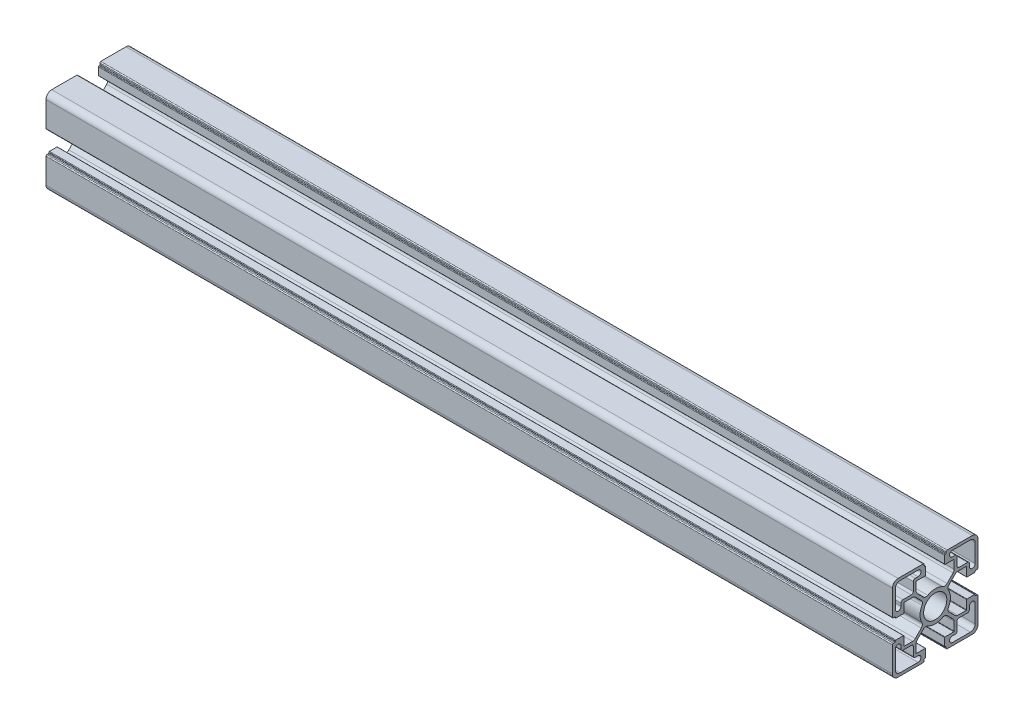
from build123d import *

# Parameters (mm, degrees)
BOSS_EXTRU_1_DEPTH = 222.5


with BuildPart() as part:
    # Esquisse1 → Boss.-Extru.1 (new, symmetric)
    with BuildSketch(Plane(origin=(0, 0, 0), x_dir=(0, 0, -1), z_dir=(1, 0, 0))):
        with BuildLine():
            Line((-22.5, 19.5), (-22.5, 6.3))
            ThreePointArc((-22.5, 6.3), (-22.353553391, 5.946446609), (-22, 5.8))
            Line((-22, 5.8), (-21.3, 5.8))
            ThreePointArc((-21.3, 5.8), (-21.087867966, 5.712132034), (-21, 5.5))
            Line((-21, 5.5), (-21, 5.3))
            ThreePointArc((-21, 5.3), (-20.912132034, 5.087867966), (-20.7, 5))
            Line((-20.7, 5), (-16.7, 5))
            ThreePointArc((-16.7, 5), (-16.558578644, 5.058578644), (-16.5, 5.2))
            Line((-16.5, 5.2), (-16.5, 9.8))
            ThreePointArc((-16.5, 9.8), (-16.441421356, 9.941421356), (-16.3, 10))
            Line((-16.3, 10), (-11.864234483, 10))
            ThreePointArc((-11.864234483, 10), (-11.121828624, 9.852326293), (-10.492447327, 9.431787156))
            Line((-10.492447327, 9.431787156), (-7.296699127, 6.236038955))
            ThreePointArc((-7.296699127, 6.236038955), (-6.746669172, 5.129240469), (-6.976648919, 3.914890784))
            ThreePointArc((-6.976648919, 3.914890784), (-7.739935121, 2.023216331), (-8, 0))
            ThreePointArc((-8, 0), (-7.739935121, -2.023216331), (-6.976648919, -3.914890784))
            ThreePointArc((-6.976648919, -3.914890784), (-6.746669172, -5.129240469), (-7.296699127, -6.236038955))
            Line((-7.296699127, -6.236038955), (-10.492447327, -9.431787156))
            ThreePointArc((-10.492447327, -9.431787156), (-11.121828624, -9.852326293), (-11.864234483, -10))
            Line((-11.864234483, -10), (-16.3, -10))
            ThreePointArc((-16.3, -10), (-16.441421356, -9.941421356), (-16.5, -9.8))
            Line((-16.5, -9.8), (-16.5, -5.2))
            ThreePointArc((-16.5, -5.2), (-16.558578644, -5.058578644), (-16.7, -5))
            Line((-16.7, -5), (-20.7, -5))
            ThreePointArc((-20.7, -5), (-20.912132034, -5.087867966), (-21, -5.3))
            Line((-21, -5.3), (-21, -5.5))
            ThreePointArc((-21, -5.5), (-21.087867966, -5.712132034), (-21.3, -5.8))
            Line((-21.3, -5.8), (-22, -5.8))
            ThreePointArc((-22, -5.8), (-22.353553391, -5.946446609), (-22.5, -6.3))
            Line((-22.5, -6.3), (-22.5, -19.5))
            ThreePointArc((-22.5, -19.5), (-21.621320344, -21.621320344), (-19.5, -22.5))
            Line((-19.5, -22.5), (-6.3, -22.5))
            ThreePointArc((-6.3, -22.5), (-5.946446609, -22.353553391), (-5.8, -22))
            Line((-5.8, -22), (-5.8, -21.3))
            ThreePointArc((-5.8, -21.3), (-5.712132034, -21.087867966), (-5.5, -21))
            Line((-5.5, -21), (-5.3, -21))
            ThreePointArc((-5.3, -21), (-5.087867966, -20.912132034), (-5, -20.7))
            Line((-5, -20.7), (-5, -16.7))
            ThreePointArc((-5, -16.7), (-5.058578644, -16.558578644), (-5.2, -16.5))
            Line((-5.2, -16.5), (-9.8, -16.5))
            ThreePointArc((-9.8, -16.5), (-9.941421356, -16.441421356), (-10, -16.3))
            Line((-10, -16.3), (-10, -11.864234483))
            ThreePointArc((-10, -11.864234483), (-9.852326293, -11.121828624), (-9.431787156, -10.492447327))
            Line((-9.431787156, -10.492447327), (-6.236038955, -7.296699127))
            ThreePointArc((-6.236038955, -7.296699127), (-5.129240469, -6.746669172), (-3.914890784, -6.976648919))
            ThreePointArc((-3.914890784, -6.976648919), (-2.023216331, -7.739935121), (0, -8))
            ThreePointArc((0, -8), (2.023216331, -7.739935121), (3.914890784, -6.976648919))
            ThreePointArc((3.914890784, -6.976648919), (5.129240469, -6.746669172), (6.236038955, -7.296699127))
            Line((6.236038955, -7.296699127), (9.431787156, -10.492447327))
            ThreePointArc((9.431787156, -10.492447327), (9.852326293, -11.121828624), (10, -11.864234483))
            Line((10, -11.864234483), (10, -16.3))
            ThreePointArc((10, -16.3), (9.941421356, -16.441421356), (9.8, -16.5))
            Line((9.8, -16.5), (5.2, -16.5))
            ThreePointArc((5.2, -16.5), (5.058578644, -16.558578644), (5, -16.7))
            Line((5, -16.7), (5, -20.7))
            ThreePointArc((5, -20.7), (5.087867966, -20.912132034), (5.3, -21))
            Line((5.3, -21), (5.5, -21))
            ThreePointArc((5.5, -21), (5.712132034, -21.087867966), (5.8, -21.3))
            Line((5.8, -21.3), (5.8, -22))
            ThreePointArc((5.8, -22), (5.946446609, -22.353553391), (6.3, -22.5))
            Line((6.3, -22.5), (19.5, -22.5))
            ThreePointArc((19.5, -22.5), (21.621320344, -21.621320344), (22.5, -19.5))
            Line((22.5, -19.5), (22.5, -6.3))
            ThreePointArc((22.5, -6.3), (22.353553391, -5.946446609), (22, -5.8))
            Line((22, -5.8), (21.3, -5.8))
            ThreePointArc((21.3, -5.8), (21.087867966, -5.712132034), (21, -5.5))
            Line((21, -5.5), (21, -5.3))
            ThreePointArc((21, -5.3), (20.912132034, -5.087867966), (20.7, -5))
            Line((20.7, -5), (16.7, -5))
            ThreePointArc((16.7, -5), (16.558578644, -5.058578644), (16.5, -5.2))
            Line((16.5, -5.2), (16.5, -9.8))
            ThreePointArc((16.5, -9.8), (16.441421356, -9.941421356), (16.3, -10))
            Line((16.3, -10), (11.864234483, -10))
            ThreePointArc((11.864234483, -10), (11.121828624, -9.852326293), (10.492447327, -9.431787156))
            Line((10.492447327, -9.431787156), (7.296699127, -6.236038955))
            ThreePointArc((7.296699127, -6.236038955), (6.746669172, -5.129240469), (6.976648919, -3.914890784))
            ThreePointArc((6.976648919, -3.914890784), (7.739935121, -2.023216331), (8, 0))
            ThreePointArc((8, 0), (7.739935121, 2.023216331), (6.976648919, 3.914890784))
            ThreePointArc((6.976648919, 3.914890784), (6.746669172, 5.129240469), (7.296699127, 6.236038955))
            Line((7.296699127, 6.236038955), (10.492447327, 9.431787156))
            ThreePointArc((10.492447327, 9.431787156), (11.121828624, 9.852326293), (11.864234483, 10))
            Line((11.864234483, 10), (16.3, 10))
            ThreePointArc((16.3, 10), (16.441421356, 9.941421356), (16.5, 9.8))
            Line((16.5, 9.8), (16.5, 5.2))
            ThreePointArc((16.5, 5.2), (16.558578644, 5.058578644), (16.7, 5))
            Line((16.7, 5), (20.7, 5))
            ThreePointArc((20.7, 5), (20.912132034, 5.087867966), (21, 5.3))
            Line((21, 5.3), (21, 5.5))
            ThreePointArc((21, 5.5), (21.087867966, 5.712132034), (21.3, 5.8))
            Line((21.3, 5.8), (22, 5.8))
            ThreePointArc((22, 5.8), (22.353553391, 5.946446609), (22.5, 6.3))
            Line((22.5, 6.3), (22.5, 19.5))
            ThreePointArc((22.5, 19.5), (21.621320344, 21.621320344), (19.5, 22.5))
            Line((19.5, 22.5), (6.3, 22.5))
            ThreePointArc((6.3, 22.5), (5.946446609, 22.353553391), (5.8, 22))
            Line((5.8, 22), (5.8, 21.3))
            ThreePointArc((5.8, 21.3), (5.712132034, 21.087867966), (5.5, 21))
            Line((5.5, 21), (5.3, 21))
            ThreePointArc((5.3, 21), (5.087867966, 20.912132034), (5, 20.7))
            Line((5, 20.7), (5, 16.7))
            ThreePointArc((5, 16.7), (5.058578644, 16.558578644), (5.2, 16.5))
            Line((5.2, 16.5), (9.8, 16.5))
            ThreePointArc((9.8, 16.5), (9.941421356, 16.441421356), (10, 16.3))
            Line((10, 16.3), (10, 11.864234483))
            ThreePointArc((10, 11.864234483), (9.852326293, 11.121828624), (9.431787156, 10.492447327))
            Line((9.431787156, 10.492447327), (6.236038955, 7.296699127))
            ThreePointArc((6.236038955, 7.296699127), (5.129240469, 6.746669172), (3.914890784, 6.976648919))
            ThreePointArc((3.914890784, 6.976648919), (2.023216331, 7.739935121), (0, 8))
            ThreePointArc((0, 8), (-2.023216331, 7.739935121), (-3.914890784, 6.976648919))
            ThreePointArc((-3.914890784, 6.976648919), (-5.129240469, 6.746669172), (-6.236038955, 7.296699127))
            Line((-6.236038955, 7.296699127), (-9.431787156, 10.492447327))
            ThreePointArc((-9.431787156, 10.492447327), (-9.852326293, 11.121828624), (-10, 11.864234483))
            Line((-10, 11.864234483), (-10, 16.3))
            ThreePointArc((-10, 16.3), (-9.941421356, 16.441421356), (-9.8, 16.5))
            Line((-9.8, 16.5), (-5.2, 16.5))
            ThreePointArc((-5.2, 16.5), (-5.058578644, 16.558578644), (-5, 16.7))
            Line((-5, 16.7), (-5, 20.7))
            ThreePointArc((-5, 20.7), (-5.087867966, 20.912132034), (-5.3, 21))
            Line((-5.3, 21), (-5.5, 21))
            ThreePointArc((-5.5, 21), (-5.712132034, 21.087867966), (-5.8, 21.3))
            Line((-5.8, 21.3), (-5.8, 22))
            ThreePointArc((-5.8, 22), (-5.946446609, 22.353553391), (-6.3, 22.5))
            Line((-6.3, 22.5), (-19.5, 22.5))
            ThreePointArc((-19.5, 22.5), (-21.621320344, 21.621320344), (-22.5, 19.5))
        make_face()
        with BuildLine():
            Line((-21, 18.5), (-21, 9))
            ThreePointArc((-21, 9), (-19.5, 7.5), (-18, 9))
            Line((-18, 9), (-18, 10.5))
            ThreePointArc((-18, 10.5), (-17.707106781, 11.207106781), (-17, 11.5))
            Line((-17, 11.5), (-12.5, 11.5))
            ThreePointArc((-12.5, 11.5), (-11.792893219, 11.792893219), (-11.5, 12.5))
            Line((-11.5, 12.5), (-11.5, 17))
            ThreePointArc((-11.5, 17), (-11.207106781, 17.707106781), (-10.5, 18))
            Line((-10.5, 18), (-9, 18))
            ThreePointArc((-9, 18), (-7.5, 19.5), (-9, 21))
            Line((-9, 21), (-18.5, 21))
            ThreePointArc((-18.5, 21), (-20.267766953, 20.267766953), (-21, 18.5))
        make_face(mode=Mode.SUBTRACT)
        with BuildLine():
            Line((18.5, 21), (9, 21))
            ThreePointArc((9, 21), (7.5, 19.5), (9, 18))
            Line((9, 18), (10.5, 18))
            ThreePointArc((10.5, 18), (11.207106781, 17.707106781), (11.5, 17))
            Line((11.5, 17), (11.5, 12.5))
            ThreePointArc((11.5, 12.5), (11.792893219, 11.792893219), (12.5, 11.5))
            Line((12.5, 11.5), (17, 11.5))
            ThreePointArc((17, 11.5), (17.707106781, 11.207106781), (18, 10.5))
            Line((18, 10.5), (18, 9))
            ThreePointArc((18, 9), (19.5, 7.5), (21, 9))
            Line((21, 9), (21, 18.5))
            ThreePointArc((21, 18.5), (20.267766953, 20.267766953), (18.5, 21))
        make_face(mode=Mode.SUBTRACT)
        with BuildLine():
            Line((21, -18.5), (21, -9))
            ThreePointArc((21, -9), (19.5, -7.5), (18, -9))
            Line((18, -9), (18, -10.5))
            ThreePointArc((18, -10.5), (17.707106781, -11.207106781), (17, -11.5))
            Line((17, -11.5), (12.5, -11.5))
            ThreePointArc((12.5, -11.5), (11.792893219, -11.792893219), (11.5, -12.5))
            Line((11.5, -12.5), (11.5, -17))
            ThreePointArc((11.5, -17), (11.207106781, -17.707106781), (10.5, -18))
            Line((10.5, -18), (9, -18))
            ThreePointArc((9, -18), (7.5, -19.5), (9, -21))
            Line((9, -21), (18.5, -21))
            ThreePointArc((18.5, -21), (20.267766953, -20.267766953), (21, -18.5))
        make_face(mode=Mode.SUBTRACT)
        with BuildLine():
            Line((-18.5, -21), (-9, -21))
            ThreePointArc((-9, -21), (-7.5, -19.5), (-9, -18))
            Line((-9, -18), (-10.5, -18))
            ThreePointArc((-10.5, -18), (-11.207106781, -17.707106781), (-11.5, -17))
            Line((-11.5, -17), (-11.5, -12.5))
            ThreePointArc((-11.5, -12.5), (-11.792893219, -11.792893219), (-12.5, -11.5))
            Line((-12.5, -11.5), (-17, -11.5))
            ThreePointArc((-17, -11.5), (-17.707106781, -11.207106781), (-18, -10.5))
            Line((-18, -10.5), (-18, -9))
            ThreePointArc((-18, -9), (-19.5, -7.5), (-21, -9))
            Line((-21, -9), (-21, -18.5))
            ThreePointArc((-21, -18.5), (-20.267766953, -20.267766953), (-18.5, -21))
        make_face(mode=Mode.SUBTRACT)
        with BuildLine():
            ThreePointArc((0, 6.1), (-4.313351365, 4.313351365), (-6.1, 0))
            ThreePointArc((-6.1, 0), (-4.313351365, -4.313351365), (0, -6.1))
            ThreePointArc((0, -6.1), (4.313351365, -4.313351365), (6.1, 0))
            ThreePointArc((6.1, 0), (4.313351365, 4.313351365), (0, 6.1))
        make_face(mode=Mode.SUBTRACT)
    extrude(amount=BOSS_EXTRU_1_DEPTH, both=True)


solid = part.part
